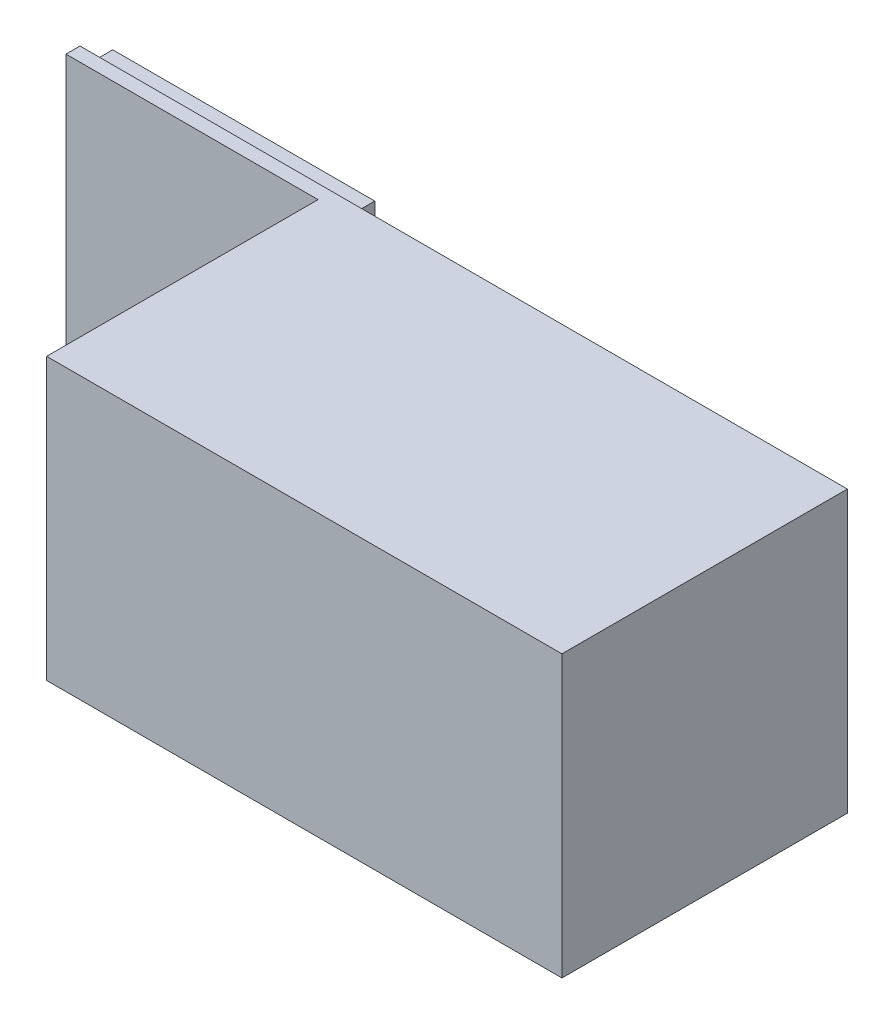
from build123d import *

# Parameters (mm, degrees)
SKETCH_1_W          = 82
SKETCH_1_H          = 30
EXTRUDE_1_DEPTH     = 1.5
SKETCH_2_W          = 1.997612732
SKETCH_2_H          = 25.79850023
EXTRUDE_3_DEPTH     = 3.5
SKETCH_4_W          = 1.75
SKETCH_4_H          = 25.79850023
EXTRUDE_4_DEPTH     = 26
SKETCH_5_W          = 55.064096776
SKETCH_5_H          = 30
EXTRUDE_5_DEPTH     = 29
SKETCH_6_W          = 26.352675357
SKETCH_6_H          = 28.194959652
CUT_EXTRUDE_1_DEPTH = 53
SKETCH_8_W          = 53
SKETCH_8_H          = 28.194959652
CUT_EXTRUDE_2_DEPTH = 1.32


with BuildPart() as part:
    # 草圖1 → 填料-伸長1 (new body)
    with BuildSketch(Plane.XY):
        Rectangle(SKETCH_1_W, SKETCH_1_H)
    extrude(amount=EXTRUDE_1_DEPTH)

    # 草圖2 → 填料-伸長3 (add)
    with BuildSketch(Plane(origin=(0, 0, 0), x_dir=(-1, 0, 0), z_dir=(0, 0, -1))):
        with Locations((40.001193634, 0)):
            Rectangle(SKETCH_2_W, SKETCH_2_H)
    extrude(amount=EXTRUDE_3_DEPTH)

    # 草圖4 → 填料-伸長4 (add)
    with BuildSketch(Plane(origin=(-39.002387268, 0, 0), x_dir=(0, 0, -1), z_dir=(1, 0, 0))):
        with Locations((2.625, 0)):
            Rectangle(SKETCH_4_W, SKETCH_4_H)
    extrude(amount=EXTRUDE_4_DEPTH)

    # 草圖5 → 填料-伸長5 (add)
    with BuildSketch(Plane.XY.offset(1.5)):
        with Locations((13.467951612, 0)):
            Rectangle(SKETCH_5_W, SKETCH_5_H)
    extrude(amount=EXTRUDE_5_DEPTH)

    # 草圖6 → 除料-伸長1 (cut)
    with BuildSketch(Plane.ZY.offset(14.064096776)):
        with Locations((15.993727328, -0.060074488)):
            Rectangle(SKETCH_6_W, SKETCH_6_H)
    extrude(amount=-CUT_EXTRUDE_1_DEPTH, mode=Mode.SUBTRACT)

    # 草圖8 → 除料-伸長2 (cut)
    with BuildSketch(Plane.XY.offset(2.817389649)):
        with Locations((12.435903224, -0.060074488)):
            Rectangle(SKETCH_8_W, SKETCH_8_H)
    extrude(amount=-CUT_EXTRUDE_2_DEPTH, mode=Mode.SUBTRACT)


solid = part.part
